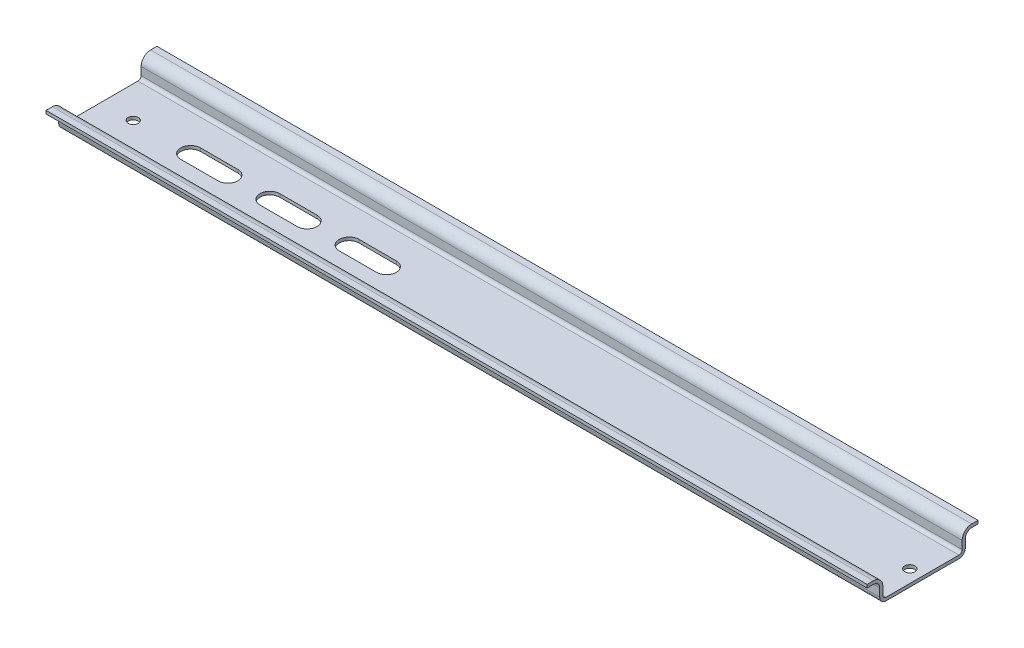
from build123d import *

# Parameters (mm, degrees)
EXTRUDE_THIN1_DEPTH        = 200
EXTRUDE_THIN1_DEPTH_BACK   = 59
CUT_EXTRUDE1_REACH         = 202.904
LPATTERN1_COUNT            = 2
LPATTERN1_PITCH            = 25
LPATTERN1_COL_COUNT        = 2
LPATTERN1_COL_PITCH        = 25
SZKIC1_R                   = 1.6
WYTNIJ_WYCI_GNI_CIE1_DEPTH = 201.904206029


with BuildPart() as part:
    # Sketch1 → Extrude-Thin1 (new, two sides: drawn at the far end of the back side and taken through both)
    with BuildSketch(Plane(origin=(0, 0, 0), x_dir=(0, 0, -1), z_dir=(1, 0, 0)).offset(-EXTRUDE_THIN1_DEPTH_BACK)):
        with BuildLine():
            Line((-17.5, 6.5), (-15.5, 6.5))
            ThreePointArc((-15.5, 6.5), (-14.085786438, 5.914213562), (-13.5, 4.5))
            Line((-13.5, 4.5), (-13.5, 2))
            ThreePointArc((-13.5, 2), (-12.914213562, 0.585786438), (-11.5, 0))
            Line((-11.5, 0), (11.5, 0))
            ThreePointArc((11.5, 0), (12.914213562, 0.585786438), (13.5, 2))
            Line((13.5, 2), (13.5, 4.5))
            ThreePointArc((13.5, 4.5), (14.085786438, 5.914213562), (15.5, 6.5))
            Line((15.5, 6.5), (17.5, 6.5))
            Line((17.5, 6.5), (17.5, 7.5))
            Line((17.5, 7.5), (15.5, 7.5))
            ThreePointArc((15.5, 7.5), (13.378679656, 6.621320344), (12.5, 4.5))
            Line((12.5, 4.5), (12.5, 2))
            ThreePointArc((12.5, 2), (12.207106781, 1.292893219), (11.5, 1))
            Line((11.5, 1), (-11.5, 1))
            ThreePointArc((-11.5, 1), (-12.207106781, 1.292893219), (-12.5, 2))
            Line((-12.5, 2), (-12.5, 4.5))
            ThreePointArc((-12.5, 4.5), (-13.378679656, 6.621320344), (-15.5, 7.5))
            Line((-15.5, 7.5), (-17.5, 7.5))
            Line((-17.5, 7.5), (-17.5, 6.5))
        make_face()
    extrude(amount=EXTRUDE_THIN1_DEPTH + EXTRUDE_THIN1_DEPTH_BACK)

    # Sketch2 → Cut-Extrude1 (cut, up to next)
    with BuildSketch(Plane.XZ, mode=Mode.PRIVATE) as cut_extrude1_sk1:
        with BuildLine():
            Line((-5.875, 3.125), (5.875, 3.125))
            ThreePointArc((5.875, 3.125), (9, 0), (5.875, -3.125))
            Line((5.875, -3.125), (-5.875, -3.125))
            ThreePointArc((-5.875, -3.125), (-9, 0), (-5.875, 3.125))
        make_face()
    cut_extrude1_tool1 = extrude(cut_extrude1_sk1.sketch, amount=-CUT_EXTRUDE1_REACH, mode=Mode.PRIVATE) & part.part
    cut_extrude1 = cut_extrude1_tool1.solids().sort_by_distance((0, 0, 0))[0]
    add(cut_extrude1, mode=Mode.SUBTRACT)

    # LPattern1: Cut-Extrude1 ×2
    with Locations(*[(i * LPATTERN1_PITCH, 0, 0) for i in range(1, LPATTERN1_COUNT)]):
        add(cut_extrude1, mode=Mode.SUBTRACT)

    # LPattern1 col: Cut-Extrude1 ×2
    with Locations(*[(-i * LPATTERN1_COL_PITCH, 0, 0) for i in range(1, LPATTERN1_COL_COUNT)]):
        add(cut_extrude1, mode=Mode.SUBTRACT)

    # Szkic1 → Wytnij-wyciągnięcie1 (cut, through all)
    with BuildSketch(Plane.XZ):
        with Locations(Location((-49, 0, 0), (0, 0, 270))):
            Circle(SZKIC1_R)
        with Locations(Location((196, 0, 0), (0, 0, 270))):
            Circle(SZKIC1_R)
    extrude(amount=-WYTNIJ_WYCI_GNI_CIE1_DEPTH, mode=Mode.SUBTRACT)


solid = part.part
